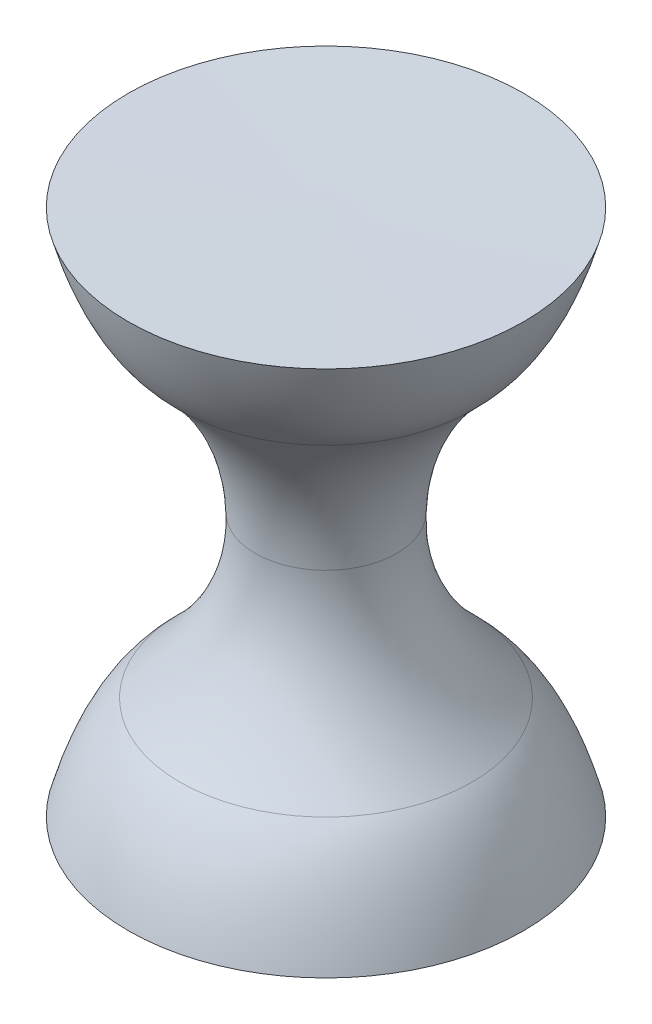
from build123d import *


with BuildPart() as part:
    # Sketch3 → Revolve4 (revolve)
    with BuildSketch(Plane.XY, mode=Mode.PRIVATE) as revolve4_sk:
        with BuildLine():
            Line((0, 39.850386163), (0, 0))
            Line((0, 0), (15, 0))
            add(Edge.make_bspline(
                [(15, 0), (13.501736771, 5.507642886), (11.075076454, 7.791231077)],
                knots=[0, 0, 0, 0.323554709, 0.323554709, 0.323554709], degree=2))
            add(Edge.make_bspline(
                [(5.366677122, 19.962596541), (5.187775382, 14.748552114), (7.842817138, 10.928220482), (11.075076454, 7.791231077)],
                knots=[0, 0, 0, 0, 0.821473584, 0.821473584, 0.821473584, 0.821473584], degree=3))
            add(Edge.make_bspline(
                [(5.366677122, 19.962596541), (5.493163631, 25.128855766), (7.842818352, 29.071779137), (11.075077667, 32.208768542)],
                knots=[0, 0, 0, 0, 0.821473584, 0.821473584, 0.821473584, 0.821473584], degree=3))
            add(Edge.make_bspline(
                [(15.000000048, 40.000000113), (13.501737985, 34.492356733), (11.075077667, 32.208768542)],
                knots=[0, 0, 0, 0.323554709, 0.323554709, 0.323554709], degree=2))
            Line((15.000000048, 40.000000113), (0, 39.850386163))
        make_face()
    revolve(revolve4_sk.sketch.rotate(Axis((0, 39.850386163, 0), (0, -1, 0)), 90), axis=Axis((0, 39.850386163, 0), (0, -1, 0)))


solid = part.part
